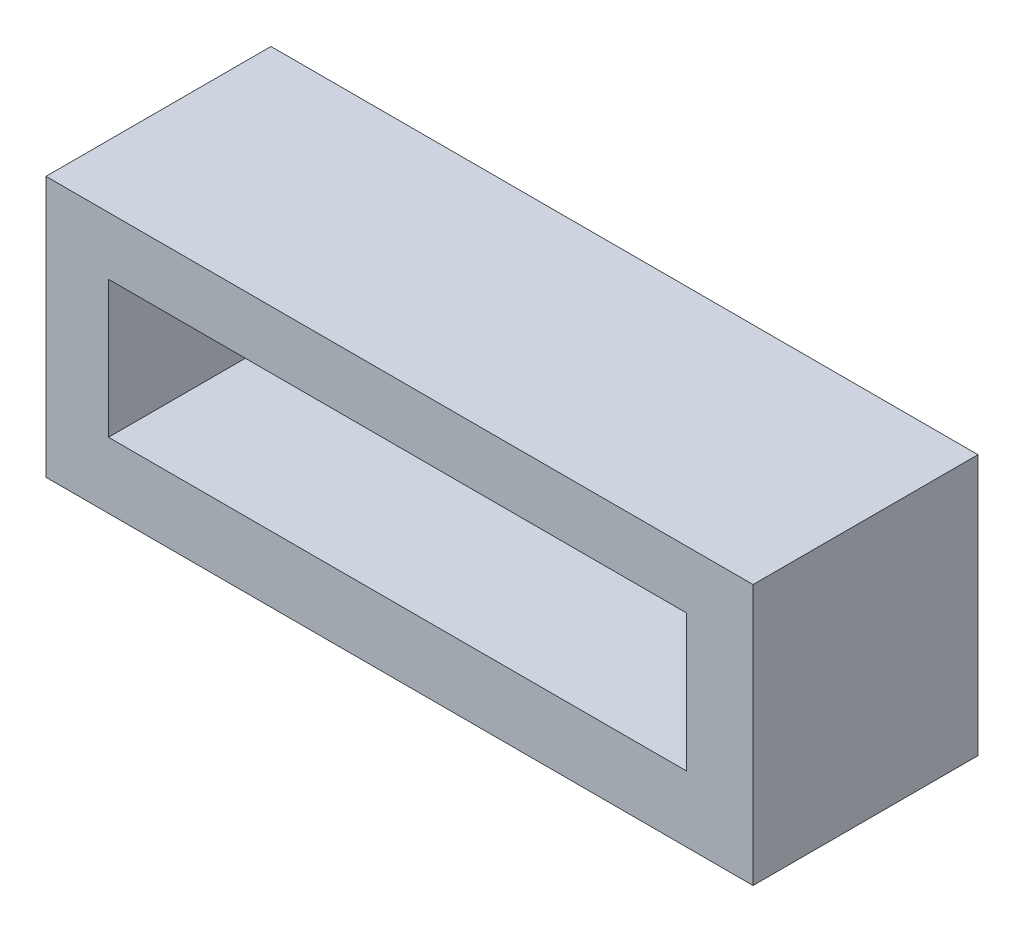
from build123d import *

# Parameters (mm, degrees)
SKETCH_1_W          = 50.29
SKETCH_1_H          = 18.54
EXTRUDE_1_DEPTH     = 16
SKETCH_2_W          = 41.112264991
SKETCH_2_H          = 9.734101739
CUT_EXTRUDE_1_DEPTH = 10


with BuildPart() as part:
    # 草圖1 → 填料-伸長1 (new body)
    with BuildSketch(Plane.XY):
        with Locations((-0.313158869, 2.593664688)):
            Rectangle(SKETCH_1_W, SKETCH_1_H)
    extrude(amount=EXTRUDE_1_DEPTH)

    # 草圖2 → 除料-伸長1 (cut)
    with BuildSketch(Plane.XY.offset(16)):
        with Locations((-0.456307424, 2.879961799)):
            Rectangle(SKETCH_2_W, SKETCH_2_H)
    extrude(amount=-CUT_EXTRUDE_1_DEPTH, mode=Mode.SUBTRACT)


solid = part.part
